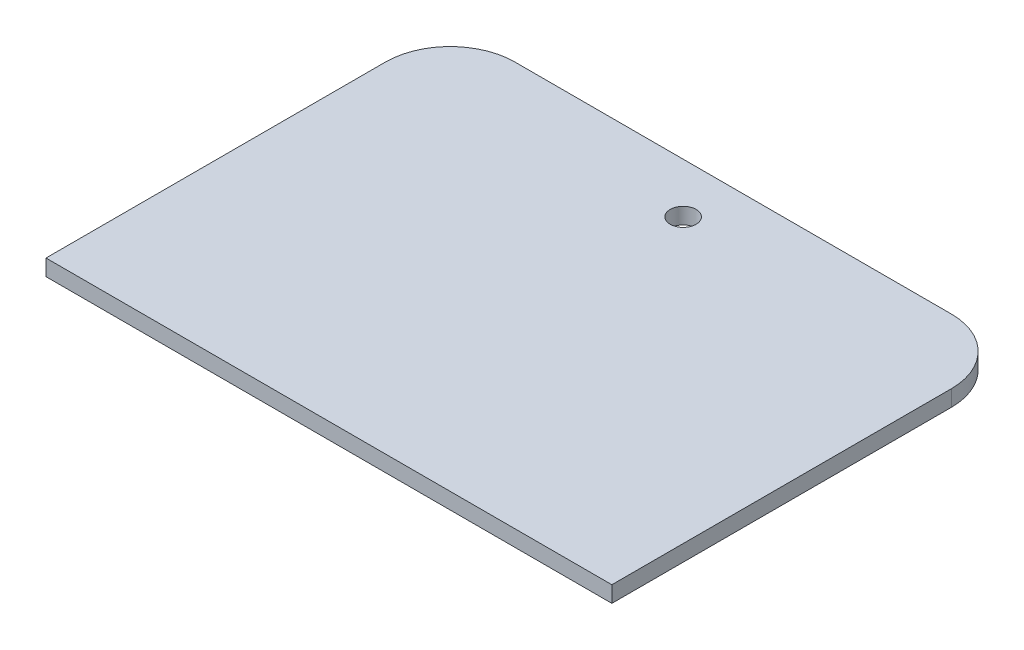
from build123d import *

# Parameters (mm, degrees)
CROQUIS1_W              = 70
CROQUIS1_H              = 50
SALIENTE_EXTRUIR1_DEPTH = 2
REDONDEO1_R             = 8
CORTAR_EXTRUIR2_REACH   = 45.058
CROQUIS3_R              = 1.6


with BuildPart() as part:
    # Croquis1 → Saliente-Extruir1 (new body)
    with BuildSketch(Plane(origin=(0, 0, 0), x_dir=(1, 0, 0), z_dir=(0, 1, 0))):
        Rectangle(CROQUIS1_W, CROQUIS1_H)
    extrude(amount=SALIENTE_EXTRUIR1_DEPTH)

    # Redondeo1
    redondeo1_edges = [part.edges().sort_by_distance(p)[0] for p in [
        (-35, 1, -25),
        (35, 1, -25),
    ]]
    fillet(redondeo1_edges, radius=REDONDEO1_R)

    # Croquis3 → Cortar-Extruir2 (cut, up to next)
    with BuildSketch(Plane(origin=(0, 2, 0), x_dir=(1, 0, 0), z_dir=(0, 1, 0)), mode=Mode.PRIVATE) as cortar_extruir2_sk1:
        with Locations(Location((0, 18.819660113, 0), (0, 0, 270))):
            Circle(CROQUIS3_R)
    cortar_extruir2_tool1 = extrude(cortar_extruir2_sk1.sketch, amount=-CORTAR_EXTRUIR2_REACH, mode=Mode.PRIVATE) & part.part
    add(cortar_extruir2_tool1.solids().sort_by_distance((0, 2, -18.81966))[0], mode=Mode.SUBTRACT)


solid = part.part
